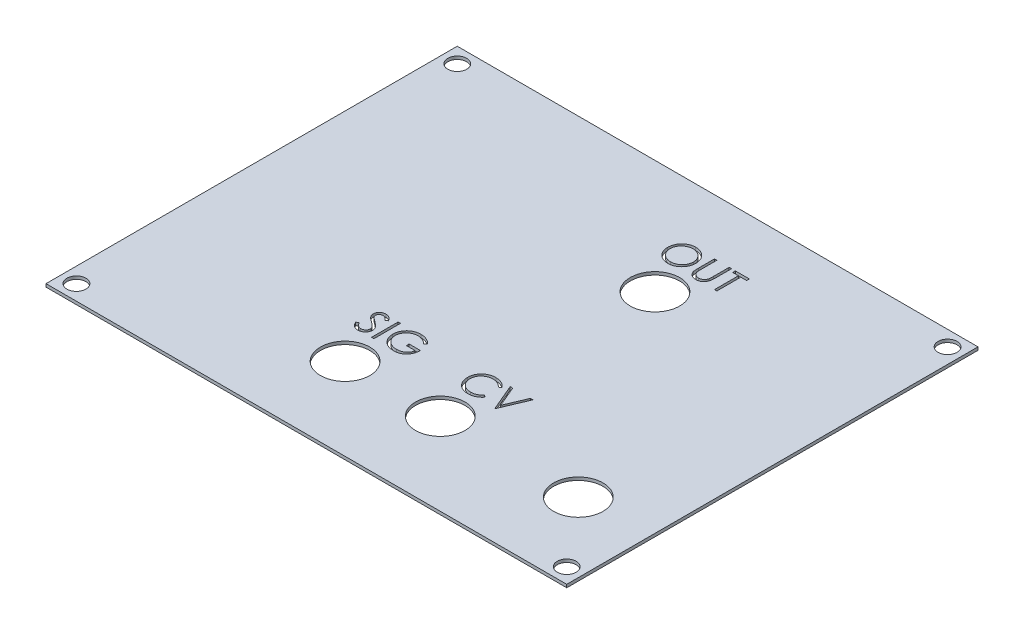
from build123d import *

# Parameters (mm, degrees)
SKETCH1_W           = 68.5
SKETCH1_H           = 54.1
SKETCH1_R           = 1.25
SKETCH1_R_2         = 3.25
BOSS_EXTRUDE1_DEPTH = 0.4
SKETCH2_W           = 0.314102564
SKETCH2_H           = 3.5
CUT_EXTRUDE1_DEPTH  = 0.4


with BuildPart() as part:
    # Sketch1 → Boss-Extrude1 (new body)
    with BuildSketch(Plane(origin=(0, 0, 0), x_dir=(1, 0, 0), z_dir=(0, 1, 0))):
        with Locations((32.25, 25.05)):
            Rectangle(SKETCH1_W, SKETCH1_H)
        with Locations(Location((0, 0, 0), (0, 0, 270))):
            Circle(SKETCH1_R, mode=Mode.SUBTRACT)
        with Locations(Location((0, 50.1, 0), (0, 0, 270))):
            Circle(SKETCH1_R, mode=Mode.SUBTRACT)
        with Locations(Location((64.5, 50.1, 0), (0, 0, 270))):
            Circle(SKETCH1_R, mode=Mode.SUBTRACT)
        with Locations(Location((64.5, 0, 0), (0, 0, 270))):
            Circle(SKETCH1_R, mode=Mode.SUBTRACT)
        with Locations(Location((26.516, 8.829, 0), (0, 0, 270))):
            Circle(SKETCH1_R_2, mode=Mode.SUBTRACT)
        with Locations(Location((39.036, 8.829, 0), (0, 0, 270))):
            Circle(SKETCH1_R_2, mode=Mode.SUBTRACT)
        with Locations(Location((57.33, 8.69, 0), (0, 0, 270))):
            Circle(SKETCH1_R_2, mode=Mode.SUBTRACT)
        with Locations(Location((38.979, 37.127, 0), (0, 0, 270))):
            Circle(SKETCH1_R_2, mode=Mode.SUBTRACT)
    extrude(amount=BOSS_EXTRUDE1_DEPTH)

    # Sketch2 → Cut-Extrude1 (cut)
    # profile 1 of 8: a face of its own
    with BuildSketch(Plane(origin=(0, 0.4, 0), x_dir=(1, 0, 0), z_dir=(0, 1, 0))):
        with BuildLine():
            Line((22.743722308, 13.978326651), (23.039595706, 14.155710465))
            add(Edge.make_bspline(
                [(23.039595706, 14.155710465), (23.067113943, 14.10964608), (23.119837824, 14.021388496), (23.207789183, 13.902130456), (23.298922094, 13.800768299), (23.393911428, 13.717891692), (23.492177376, 13.652642805), (23.59436143, 13.606440573), (23.70011924, 13.577624598), (23.772093062, 13.574124511), (23.808025193, 13.572377132)],
                knots=[0, 0, 0, 0, 1.272034388, 2.437168799, 3.508375237, 4.49857839, 5.41946034, 6.295179144, 7.148887113, 8, 8, 8, 8], degree=3))
            add(Edge.make_bspline(
                [(23.808025193, 13.572377132), (23.838712054, 13.573231804), (23.899548827, 13.574926195), (23.98911107, 13.591206997), (24.076092872, 13.616219126), (24.15870151, 13.652040057), (24.235797124, 13.695378543), (24.303403819, 13.74772472), (24.361849933, 13.806330926), (24.409659047, 13.871713581), (24.446339083, 13.942030729), (24.474531151, 14.014206681), (24.490176225, 14.089375249), (24.492532978, 14.139985712), (24.493722308, 14.16552617)],
                knots=[0, 0, 0, 0, 1.095163259, 2.171163733, 3.241058638, 4.321873601, 5.38011039, 6.391990106, 7.366004449, 8.327778327, 9.272591725, 10.192022065, 11.087607919, 12, 12, 12, 12], degree=3))
            add(Edge.make_bspline(
                [(24.493722308, 14.16552617), (24.492247998, 14.19466702), (24.48925094, 14.253906109), (24.46391946, 14.341305762), (24.424070213, 14.427798332), (24.387307569, 14.481299598), (24.368221507, 14.50907585)],
                knots=[0, 0, 0, 0, 0.938893495, 1.908633276, 2.914225137, 4, 4, 4, 4], degree=3))
            add(Edge.make_bspline(
                [(24.368221507, 14.50907585), (24.352550893, 14.529122673), (24.319652399, 14.571208472), (24.263094886, 14.633853707), (24.196728772, 14.698472126), (24.122825217, 14.767531183), (24.038692128, 14.83781898), (23.946964614, 14.912687258), (23.845300755, 14.989288835), (23.774001258, 15.040661401), (23.737211892, 15.067168799)],
                knots=[0, 0, 0, 0, 0.722233717, 1.516239348, 2.393582979, 3.351407094, 4.387010283, 5.505090956, 6.712668013, 8, 8, 8, 8], degree=3))
            add(Edge.make_bspline(
                [(23.737211892, 15.067168799), (23.700387896, 15.093397386), (23.629983219, 15.143544448), (23.531524637, 15.217968732), (23.443480174, 15.286012602), (23.366241157, 15.348316614), (23.29984156, 15.404889219), (23.243758149, 15.455187158), (23.199419592, 15.500570719), (23.174764012, 15.530012061), (23.163694264, 15.543230497)],
                knots=[0, 0, 0, 0, 1.452282411, 2.77665338, 3.964542531, 5.026858415, 5.96415736, 6.766646006, 7.446254459, 8, 8, 8, 8], degree=3))
            add(Edge.make_bspline(
                [(23.163694264, 15.543230497), (23.148221718, 15.563831534), (23.117792882, 15.604346238), (23.077626876, 15.667671096), (23.043487713, 15.732494361), (23.016725381, 15.798990226), (22.994189162, 15.866225154), (22.979031232, 15.9350764), (22.969539835, 16.005235019), (22.968567848, 16.052448519), (22.968081283, 16.076083061)],
                knots=[0, 0, 0, 0, 1.068054152, 2.10047183, 3.106115577, 4.101338837, 5.06977816, 6.043150881, 7.020423561, 8, 8, 8, 8], degree=3))
            add(Edge.make_bspline(
                [(22.968081283, 16.076083061), (22.969386492, 16.113112836), (22.971969012, 16.1863809), (22.993809529, 16.29341173), (23.028282423, 16.395598147), (23.076577311, 16.491928481), (23.138834664, 16.579894462), (23.210880638, 16.660507949), (23.296692124, 16.728276531), (23.390844747, 16.787488589), (23.49390112, 16.833834515), (23.601892023, 16.868795495), (23.714989095, 16.888604753), (23.79159223, 16.891447517), (23.830461091, 16.892889952)],
                knots=[0, 0, 0, 0, 1.005424448, 1.989358655, 2.955360095, 3.929531133, 4.905563448, 5.876582895, 6.856512386, 7.866279853, 8.892233794, 9.918561126, 10.94386622, 12, 12, 12, 12], degree=3))
            add(Edge.make_bspline(
                [(23.830461091, 16.892889952), (23.871705191, 16.891467401), (23.953726543, 16.8886384), (24.074375758, 16.864040868), (24.190536475, 16.823340197), (24.283979739, 16.777151539), (24.357112501, 16.731020123), (24.412885234, 16.689000299), (24.469402684, 16.64062519), (24.527120739, 16.585765944), (24.585061399, 16.523919193), (24.644084851, 16.455508504), (24.70432912, 16.380951948), (24.74308498, 16.327727447), (24.762953078, 16.300442036)],
                knots=[0, 0, 0, 0, 1.286793592, 2.559021753, 3.825965368, 5.121522368, 5.803751409, 6.523245864, 7.299691795, 8.125521123, 9.008227632, 9.944561021, 10.946284179, 12, 12, 12, 12], degree=3))
            Line((24.762953078, 16.300442036), (24.478998751, 16.085197645))
            add(Edge.make_bspline(
                [(24.478998751, 16.085197645), (24.461852818, 16.107286335), (24.428833761, 16.149823988), (24.378704274, 16.209395304), (24.331455626, 16.263811783), (24.284905227, 16.311076911), (24.241511595, 16.353779045), (24.199394553, 16.390338802), (24.159160202, 16.421114397), (24.108443291, 16.453957957), (24.044725573, 16.486514461), (23.964741037, 16.514063539), (23.881154761, 16.530618601), (23.82422513, 16.532807488), (23.795405001, 16.533915593)],
                knots=[0, 0, 0, 0, 1.181633172, 2.275549214, 3.290209073, 4.226197932, 5.078386478, 5.862611352, 6.581680152, 7.217281963, 8.414376989, 9.595101626, 10.782541182, 12, 12, 12, 12], degree=3))
            add(Edge.make_bspline(
                [(23.795405001, 16.533915593), (23.759248478, 16.532703893), (23.689524031, 16.530367244), (23.590533795, 16.504847259), (23.50143987, 16.464665399), (23.424887305, 16.408350421), (23.361150328, 16.341629428), (23.315044869, 16.264850573), (23.287294704, 16.18006817), (23.283908425, 16.120926514), (23.282183847, 16.090806619)],
                knots=[0, 0, 0, 0, 1.14458467, 2.207223713, 3.21896685, 4.227309161, 5.202851033, 6.127160689, 7.046193047, 8, 8, 8, 8], degree=3))
            add(Edge.make_bspline(
                [(23.282183847, 16.090806619), (23.282576974, 16.07205514), (23.28336387, 16.034521521), (23.294338667, 15.979070099), (23.308437996, 15.92375876), (23.330780628, 15.868836177), (23.361625932, 15.813341818), (23.402131108, 15.75632008), (23.45314442, 15.697268372), (23.492221432, 15.658860998), (23.512852917, 15.638583061)],
                knots=[0, 0, 0, 0, 0.858281714, 1.717966888, 2.583508476, 3.4729293, 4.427298488, 5.488583878, 6.674047936, 8, 8, 8, 8], degree=3))
            add(Edge.make_bspline(
                [(23.512852917, 15.638583061), (23.52051429, 15.631746036), (23.538715957, 15.615502827), (23.571991883, 15.588910547), (23.615934681, 15.556107774), (23.669396882, 15.515520458), (23.733364244, 15.468438996), (23.8078438, 15.415465383), (23.892005333, 15.354879924), (23.951727249, 15.312522384), (23.983305642, 15.290125529)],
                knots=[0, 0, 0, 0, 0.420754252, 0.999615792, 1.744751191, 2.668019286, 3.750313428, 4.999500688, 6.413464383, 8, 8, 8, 8], degree=3))
            add(Edge.make_bspline(
                [(23.983305642, 15.290125529), (24.021291555, 15.26248417), (24.094846012, 15.208960508), (24.199503591, 15.128544828), (24.2943974, 15.049897059), (24.379860603, 14.973519452), (24.456737512, 14.899991359), (24.524175232, 14.828428179), (24.582860913, 14.759342606), (24.646040131, 14.670770031), (24.710597951, 14.561988946), (24.766039458, 14.428710708), (24.800997805, 14.294914387), (24.805569321, 14.204987551), (24.807824873, 14.160618318)],
                knots=[0, 0, 0, 0, 1.163667725, 2.253281268, 3.268753668, 4.215851969, 5.092017293, 5.902905408, 6.650798638, 7.335211899, 8.59617414, 9.77448103, 10.901945474, 12, 12, 12, 12], degree=3))
            add(Edge.make_bspline(
                [(24.807824873, 14.160618318), (24.807167734, 14.129239953), (24.805866219, 14.067092569), (24.790905306, 13.975837492), (24.76898564, 13.887206623), (24.735948407, 13.80229551), (24.695625248, 13.719550747), (24.644459, 13.641142847), (24.585151316, 13.565336448), (24.517117551, 13.494152957), (24.442671648, 13.428806761), (24.363987954, 13.3706777), (24.280937681, 13.322209376), (24.193971364, 13.282658534), (24.103069027, 13.251725017), (24.008261244, 13.229312147), (23.909391732, 13.215556437), (23.842191251, 13.214128675), (23.808025193, 13.213402773)],
                knots=[0, 0, 0, 0, 0.983748083, 1.948392443, 2.894712957, 3.844097841, 4.80183111, 5.778335162, 6.776009319, 7.81870978, 8.863265674, 9.881300176, 10.883814829, 11.87499822, 12.874611388, 13.892143829, 14.928324115, 16, 16, 16, 16], degree=3))
            add(Edge.make_bspline(
                [(23.808025193, 13.213402773), (23.78158985, 13.213913954), (23.72905209, 13.21492988), (23.651342608, 13.22391116), (23.575203019, 13.236618264), (23.501588737, 13.256792334), (23.429551325, 13.281269311), (23.359404091, 13.311407643), (23.291113037, 13.347524845), (23.224295454, 13.38881987), (23.159121279, 13.436877614), (23.096201812, 13.492851111), (23.033472626, 13.555196616), (22.97278523, 13.625607179), (22.912912085, 13.702945262), (22.855033676, 13.787934445), (22.797951958, 13.880111799), (22.76213649, 13.944976885), (22.743722308, 13.978326651)],
                knots=[0, 0, 0, 0, 0.915332311, 1.819136955, 2.706846663, 3.586547465, 4.459518054, 5.340707479, 6.227863349, 7.133153174, 8.059268498, 9.028702269, 10.047606654, 11.120612155, 12.245963614, 13.433783089, 14.680604001, 16, 16, 16, 16], degree=3))
        make_face()
    # profile 2 of 8: a face of its own
    with BuildSketch(Plane(origin=(0, 0.4, 0), x_dir=(1, 0, 0), z_dir=(0, 1, 0))):
        with Locations((25.682824873, 15.053146363)):
            Rectangle(SKETCH2_W, SKETCH2_H)
    # profile 3 of 8: a face of its own
    with BuildSketch(Plane(origin=(0, 0.4, 0), x_dir=(1, 0, 0), z_dir=(0, 1, 0))):
        with BuildLine():
            Line((30.012953078, 16.205790593), (29.743722308, 15.95058226))
            add(Edge.make_bspline(
                [(29.743722308, 15.95058226), (29.69500342, 15.996413123), (29.598727374, 16.086981986), (29.441767131, 16.204492981), (29.278003497, 16.305159081), (29.108291, 16.387065318), (28.936832446, 16.452418078), (28.76590367, 16.498946218), (28.597257969, 16.528618756), (28.48509075, 16.532167125), (28.429820065, 16.533915593)],
                knots=[0, 0, 0, 0, 1.08915593, 2.152340314, 3.188132944, 4.216796309, 5.218260357, 6.173443236, 7.099959455, 8, 8, 8, 8], degree=3))
            add(Edge.make_bspline(
                [(28.429820065, 16.533915593), (28.395905365, 16.533501987), (28.328163924, 16.532675848), (28.22754198, 16.522131633), (28.127975343, 16.506966769), (28.029651969, 16.485024891), (27.932380682, 16.457215832), (27.83649979, 16.422430369), (27.741830435, 16.381875124), (27.649264354, 16.335012651), (27.559523851, 16.283532804), (27.474767015, 16.226484264), (27.394453616, 16.165695474), (27.320093191, 16.099644494), (27.251258004, 16.028929629), (27.186309632, 15.954866323), (27.127532336, 15.875431104), (27.074441171, 15.792085478), (27.027079553, 15.706293289), (26.985270899, 15.618880299), (26.950173811, 15.530136445), (26.922404356, 15.439950367), (26.899493702, 15.349019777), (26.883376095, 15.256715057), (26.874289373, 15.162937371), (26.872717593, 15.100140113), (26.871927437, 15.068571042)],
                knots=[0, 0, 0, 0, 1.02818874, 2.053710826, 3.065248034, 4.081641283, 5.106893873, 6.131558223, 7.173050175, 8.228653731, 9.27666206, 10.308777013, 11.325269123, 12.329503258, 13.32196095, 14.316845687, 15.314881793, 16.315733098, 17.311955233, 18.285320748, 19.252783886, 20.203351036, 21.145449891, 22.095197417, 23.042428769, 24, 24, 24, 24], degree=3))
            add(Edge.make_bspline(
                [(26.871927437, 15.068571042), (26.872683155, 15.036300225), (26.874192528, 14.971846711), (26.883852847, 14.875652639), (26.901781088, 14.780887236), (26.925748797, 14.687239103), (26.955729612, 14.594547855), (26.993102279, 14.503215345), (27.037367879, 14.413244954), (27.088604431, 14.325447337), (27.144790635, 14.239924314), (27.207733716, 14.159364792), (27.274594299, 14.082696015), (27.347808199, 14.011620251), (27.425027741, 13.944236355), (27.508560017, 13.882400833), (27.596762478, 13.82492261), (27.689769689, 13.77252609), (27.786572472, 13.725717555), (27.885829225, 13.684093658), (27.987857041, 13.649814321), (28.09211973, 13.621876217), (28.198493002, 13.59897592), (28.307516805, 13.58424344), (28.418389513, 13.573552609), (28.493128145, 13.572770939), (28.530781603, 13.572377132)],
                knots=[0, 0, 0, 0, 0.93586088, 1.869166235, 2.799637598, 3.729985548, 4.670839027, 5.622275134, 6.589130586, 7.576015415, 8.568469353, 9.55398029, 10.53834874, 11.515998671, 12.510579167, 13.508179873, 14.527009472, 15.561807829, 16.601455013, 17.643573243, 18.680854198, 19.719860599, 20.772568776, 21.833555941, 22.908541556, 24, 24, 24, 24], degree=3))
            add(Edge.make_bspline(
                [(28.530781603, 13.572377132), (28.576159951, 13.573325708), (28.665267708, 13.575188392), (28.796254151, 13.589688681), (28.922057221, 13.612335475), (29.042323425, 13.645501372), (29.157192445, 13.687805047), (29.267085387, 13.738800433), (29.371137045, 13.800443492), (29.469660219, 13.870017359), (29.560417404, 13.947532192), (29.642271528, 14.031176647), (29.713917018, 14.120544714), (29.776421717, 14.215110029), (29.828130371, 14.315655334), (29.870573166, 14.421687896), (29.903106458, 14.533255408), (29.916461433, 14.61034704), (29.923209488, 14.649300209)],
                knots=[0, 0, 0, 0, 1.13008108, 2.219097802, 3.278683437, 4.311054135, 5.322181354, 6.324827112, 7.324222904, 8.330512327, 9.32562643, 10.293043162, 11.24128371, 12.174520618, 13.111833804, 14.052305215, 15.015860969, 16, 16, 16, 16], degree=3))
            Line((29.923209488, 14.649300209), (28.756542821, 14.649300209))
            Line((28.756542821, 14.649300209), (28.756542821, 15.008274568))
            Line((28.756542821, 15.008274568), (30.237312052, 15.008274568))
            add(Edge.make_bspline(
                [(30.237312052, 15.008274568), (30.235606204, 14.941367079), (30.23226755, 14.810417037), (30.208848635, 14.619446766), (30.171032122, 14.439075073), (30.11937181, 14.269112001), (30.05249653, 14.109798409), (29.971124002, 13.960972542), (29.873951881, 13.823595862), (29.764441439, 13.696546858), (29.641541481, 13.583217646), (29.508572861, 13.483611708), (29.365315893, 13.399709093), (29.211906086, 13.33144843), (29.048845652, 13.278174435), (28.875757272, 13.240402859), (28.692875672, 13.217772895), (28.567538995, 13.214881516), (28.503437853, 13.213402773)],
                knots=[0, 0, 0, 0, 1.140356446, 2.231883559, 3.274166699, 4.278491846, 5.25512956, 6.21435461, 7.1637429, 8.11826594, 9.068280886, 10.0076534, 10.945064095, 11.891975133, 12.864533718, 13.863980011, 14.907571808, 16, 16, 16, 16], degree=3))
            add(Edge.make_bspline(
                [(28.503437853, 13.213402773), (28.463927718, 13.213971894), (28.386000997, 13.215094385), (28.270910069, 13.223071732), (28.158992449, 13.235352308), (28.05026444, 13.253897432), (27.944326097, 13.276612086), (27.841706513, 13.305698805), (27.74201477, 13.339367504), (27.645096785, 13.377663178), (27.551832238, 13.422034834), (27.461805721, 13.471344474), (27.374519595, 13.525337834), (27.29056843, 13.58494868), (27.209514809, 13.64973114), (27.131881365, 13.719815059), (27.057233487, 13.794986179), (27.010473024, 13.848365189), (26.986911411, 13.875261747)],
                knots=[0, 0, 0, 0, 1.107784379, 2.184907829, 3.233506516, 4.263428166, 5.276301166, 6.270063455, 7.25232949, 8.225834625, 9.190232166, 10.146266622, 11.1027726, 12.066435141, 13.031522626, 14.010570082, 14.99756817, 16, 16, 16, 16], degree=3))
            add(Edge.make_bspline(
                [(26.986911411, 13.875261747), (26.952725479, 13.9179324), (26.884921066, 14.002565417), (26.79764291, 14.138165362), (26.723241507, 14.278567222), (26.662873685, 14.42416185), (26.615735599, 14.574813063), (26.581929346, 14.730328354), (26.562122057, 14.890907985), (26.559268519, 14.99957325), (26.557824873, 15.054548606)],
                knots=[0, 0, 0, 0, 1.023165419, 2.029347347, 3.013907458, 3.994755782, 4.975994455, 5.96558838, 6.970761222, 8, 8, 8, 8], degree=3))
            add(Edge.make_bspline(
                [(26.557824873, 15.054548606), (26.558357111, 15.095714859), (26.559414823, 15.177524166), (26.572240339, 15.298981474), (26.590641757, 15.418282166), (26.617688811, 15.535328722), (26.651785076, 15.650199314), (26.694338562, 15.762947278), (26.743883458, 15.873639149), (26.801468954, 15.981513017), (26.865553414, 16.08513743), (26.935103634, 16.184095234), (27.011107234, 16.276584299), (27.092323034, 16.363775947), (27.179720024, 16.444574794), (27.272479448, 16.519728905), (27.370672791, 16.58933909), (27.474608971, 16.652308925), (27.582736655, 16.708872546), (27.694796656, 16.758461757), (27.810754767, 16.799445073), (27.929742245, 16.834218852), (28.052659746, 16.859933993), (28.178615282, 16.878582738), (28.308265394, 16.891343338), (28.395901424, 16.892369594), (28.440336892, 16.892889952)],
                knots=[0, 0, 0, 0, 1.008945113, 2.00506715, 2.99143336, 3.967273523, 4.948097931, 5.927297278, 6.919902385, 7.919676788, 8.923139349, 9.905703106, 10.883022732, 11.856032218, 12.825136022, 13.798837087, 14.781400844, 15.773989409, 16.776158564, 17.77167057, 18.775803737, 19.789618931, 20.80898985, 21.851988756, 22.910860228, 24, 24, 24, 24], degree=3))
            add(Edge.make_bspline(
                [(28.440336892, 16.892889952), (28.476575135, 16.892310461), (28.548431314, 16.891161397), (28.655357047, 16.883196749), (28.760630061, 16.870572867), (28.864406451, 16.853346081), (28.966332817, 16.82988239), (29.066699523, 16.801804106), (29.165652059, 16.769112283), (29.262880308, 16.730123437), (29.359038024, 16.685869812), (29.454659865, 16.636056389), (29.549419111, 16.579831385), (29.643480092, 16.517027849), (29.73743595, 16.448724431), (29.829800592, 16.372967608), (29.922803537, 16.292744852), (29.982605351, 16.235062668), (30.012953078, 16.205790593)],
                knots=[0, 0, 0, 0, 0.985871117, 1.954866573, 2.915460327, 3.869826059, 4.81536089, 5.759505086, 6.70452669, 7.649098992, 8.607881297, 9.583363685, 10.581137262, 11.603961102, 12.659522466, 13.73993555, 14.853081303, 16, 16, 16, 16], degree=3))
        make_face()
    # profile 4 of 8: a face of its own
    with BuildSketch(Plane(origin=(0, 0.4, 0), x_dir=(1, 0, 0), z_dir=(0, 1, 0))):
        with BuildLine():
            Line((39.813470763, 16.159843315), (39.538631019, 15.949506777))
            add(Edge.make_bspline(
                [(39.538631019, 15.949506777), (39.519025131, 15.972872747), (39.480077684, 16.019289663), (39.417418481, 16.084469207), (39.352116838, 16.145534468), (39.284197717, 16.202776348), (39.212438598, 16.254193114), (39.138577799, 16.302464217), (39.061379754, 16.345731955), (38.954628019, 16.398194941), (38.814980171, 16.452941096), (38.639185332, 16.498844327), (38.455674233, 16.528065503), (38.330476634, 16.531230344), (38.266796083, 16.53284011)],
                knots=[0, 0, 0, 0, 0.757959112, 1.505699292, 2.245454638, 2.979532153, 3.711538275, 4.438200793, 5.171680507, 5.909471876, 7.393775596, 8.890124382, 10.418191784, 12, 12, 12, 12], degree=3))
            add(Edge.make_bspline(
                [(38.266796083, 16.53284011), (38.231712784, 16.532436148), (38.161871791, 16.531631972), (38.058223318, 16.521022847), (37.956510267, 16.506111637), (37.8567988, 16.483986313), (37.759215842, 16.456013694), (37.66312344, 16.42258828), (37.56991284, 16.381233441), (37.478294602, 16.335525181), (37.390515391, 16.283897736), (37.307460343, 16.227584384), (37.229432375, 16.167215288), (37.156369763, 16.102564181), (37.088197815, 16.033922221), (37.025410504, 15.960557879), (36.968225094, 15.882705706), (36.915508069, 15.801392298), (36.868295335, 15.716854506), (36.828765456, 15.628779436), (36.793760334, 15.538675333), (36.766061091, 15.445524172), (36.744136574, 15.349981406), (36.729008911, 15.251790618), (36.71852044, 15.151156939), (36.717720263, 15.082947626), (36.717316917, 15.048565271)],
                knots=[0, 0, 0, 0, 1.054917814, 2.100044995, 3.131103042, 4.146048494, 5.169673617, 6.183595914, 7.203665975, 8.234915748, 9.262203917, 10.264457458, 11.251630812, 12.227803204, 13.197192746, 14.159520551, 15.12972552, 16.100847026, 17.073214652, 18.039054194, 19.002613845, 19.979014051, 20.95965708, 21.949030935, 22.966165397, 24, 24, 24, 24], degree=3))
            add(Edge.make_bspline(
                [(36.717316917, 15.048565271), (36.718578736, 14.996833951), (36.72105615, 14.895266366), (36.743104484, 14.746495755), (36.776609575, 14.603975081), (36.826825152, 14.468595239), (36.888744203, 14.338686881), (36.966984814, 14.216448028), (37.057601352, 14.100031463), (37.161875771, 13.992188515), (37.276281587, 13.89367479), (37.399029499, 13.806924209), (37.529813786, 13.734609326), (37.667190417, 13.67443338), (37.812216531, 13.628176652), (37.964631333, 13.595612528), (38.124103328, 13.574370348), (38.233072728, 13.57233666), (38.288530859, 13.571301649)],
                knots=[0, 0, 0, 0, 1.029171465, 2.020641659, 2.987623507, 3.938342917, 4.889210282, 5.84687017, 6.821220943, 7.821438502, 8.827599549, 9.822697543, 10.807740252, 11.797342354, 12.80366471, 13.83203677, 14.896651826, 16, 16, 16, 16], degree=3))
            add(Edge.make_bspline(
                [(38.288530859, 13.571301649), (38.349633548, 13.572990429), (38.469898257, 13.576314351), (38.646266283, 13.6044736), (38.815102049, 13.650131518), (38.976414635, 13.71402944), (39.129749281, 13.797094728), (39.275345942, 13.897792606), (39.413327512, 14.017080938), (39.496298795, 14.108164067), (39.538631019, 14.154634982)],
                knots=[0, 0, 0, 0, 1.028121516, 2.023589091, 2.998037872, 3.967518031, 4.937445131, 5.927275754, 6.942489185, 8, 8, 8, 8], degree=3))
            Line((39.538631019, 14.154634982), (39.813470763, 13.946401809))
            add(Edge.make_bspline(
                [(39.813470763, 13.946401809), (39.791352653, 13.917863357), (39.747222378, 13.860923151), (39.675764361, 13.780651441), (39.600487063, 13.705147406), (39.520831353, 13.635019784), (39.437713562, 13.568865319), (39.349641249, 13.508563487), (39.257772217, 13.453272603), (39.162417738, 13.402645679), (39.063679125, 13.357728432), (38.96167469, 13.319274664), (38.856844115, 13.286149774), (38.749182606, 13.258897838), (38.638466849, 13.237626754), (38.525096375, 13.223407079), (38.4088265, 13.213665164), (38.330385079, 13.212777249), (38.290634224, 13.21232729)],
                knots=[0, 0, 0, 0, 0.986787822, 1.968848986, 2.935600012, 3.899624008, 4.868462664, 5.837806735, 6.815139263, 7.798259679, 8.787526145, 9.778297419, 10.776456485, 11.791383307, 12.812564526, 13.85620153, 14.913611965, 16, 16, 16, 16], degree=3))
            add(Edge.make_bspline(
                [(38.290634224, 13.21232729), (38.252990557, 13.212589282), (38.178554867, 13.21310734), (38.068656115, 13.221499508), (37.961666535, 13.232949244), (37.857891909, 13.250189376), (37.756765934, 13.270533716), (37.659205349, 13.297804972), (37.564250139, 13.328354139), (37.472281798, 13.364259126), (37.383222098, 13.404775308), (37.297358287, 13.450566867), (37.214729855, 13.501248732), (37.134524434, 13.555703742), (37.05792685, 13.615681044), (36.984273325, 13.680347678), (36.913150849, 13.749485689), (36.869148164, 13.799340543), (36.847024449, 13.824406617)],
                knots=[0, 0, 0, 0, 1.114604814, 2.203992996, 3.262667896, 4.300477797, 5.318619304, 6.316056647, 7.298880507, 8.271930387, 9.238335007, 10.195173496, 11.151986948, 12.108099108, 13.064862484, 14.031167946, 15.010108607, 16, 16, 16, 16], degree=3))
            add(Edge.make_bspline(
                [(36.847024449, 13.824406617), (36.811588805, 13.867947806), (36.741145328, 13.954504516), (36.651019645, 14.094790497), (36.573872089, 14.241258706), (36.511496169, 14.394678635), (36.462733436, 14.554706022), (36.42895224, 14.721421537), (36.407000636, 14.894669479), (36.404490347, 15.012506267), (36.403214352, 15.072403412)],
                knots=[0, 0, 0, 0, 0.994628077, 1.977248131, 2.950237994, 3.925870899, 4.908910175, 5.911660606, 6.938484602, 8, 8, 8, 8], degree=3))
            add(Edge.make_bspline(
                [(36.403214352, 15.072403412), (36.404769546, 15.135358865), (36.407829292, 15.25921979), (36.433825088, 15.440993743), (36.475643884, 15.615145142), (36.535040772, 15.781348886), (36.610346124, 15.940479167), (36.703372738, 16.091320371), (36.81303988, 16.234837171), (36.938487448, 16.368851922), (37.076054783, 16.491391275), (37.223373597, 16.599197479), (37.380155544, 16.688914995), (37.544673395, 16.763911157), (37.718159077, 16.82155562), (37.900242446, 16.861908807), (38.090581361, 16.887025923), (38.220443786, 16.890201131), (38.286427493, 16.891814469)],
                knots=[0, 0, 0, 0, 1.032925535, 2.032216505, 3.007276963, 3.968222605, 4.92396291, 5.891752235, 6.871517503, 7.883894988, 8.900124299, 9.891468569, 10.874487609, 11.85992873, 12.854644235, 13.869047385, 14.917252991, 16, 16, 16, 16], degree=3))
            add(Edge.make_bspline(
                [(38.286427493, 16.891814469), (38.326641965, 16.891332331), (38.406242463, 16.890377987), (38.523995115, 16.881071845), (38.638637442, 16.865558239), (38.750248424, 16.844442169), (38.85937104, 16.818234847), (38.965171281, 16.784094549), (39.068269968, 16.745058018), (39.168016876, 16.700099552), (39.263933426, 16.64963281), (39.355989745, 16.594217187), (39.443454604, 16.533921381), (39.526943452, 16.469258206), (39.605059663, 16.398859647), (39.680021142, 16.324662051), (39.74928222, 16.244528227), (39.792035415, 16.188123293), (39.813470763, 16.159843315)],
                knots=[0, 0, 0, 0, 1.096760587, 2.17092713, 3.219439832, 4.250915756, 5.268269357, 6.278326846, 7.281116186, 8.274029601, 9.260640565, 10.235837813, 11.203064059, 12.156899882, 13.114053108, 14.069676657, 15.032185724, 16, 16, 16, 16], degree=3))
        make_face()
    # profile 5 of 8: a face of its own
    with BuildSketch(Plane(origin=(0, 0.4, 0), x_dir=(1, 0, 0), z_dir=(0, 1, 0))):
        Polygon((40.262188711, 16.80207088), (40.598727173, 16.80207088), (41.764692718, 14.045961104), (42.931359384, 16.80207088), (43.268598968, 16.80207088), (41.787829737, 13.30207088), (41.742957942, 13.30207088), align=None)
    # profile 6 of 8: a face of its own
    with BuildSketch(Plane(origin=(0, 0.4, 0), x_dir=(1, 0, 0), z_dir=(0, 1, 0))):
        with BuildLine():
            add(Edge.make_bspline(
                [(36.566035617, 44.885724828), (36.630843723, 44.884083348), (36.75813219, 44.880859347), (36.945207088, 44.856180244), (37.123802183, 44.813484854), (37.295372322, 44.756621871), (37.457865298, 44.680767486), (37.612504191, 44.589082338), (37.758921064, 44.480605879), (37.895142446, 44.356176652), (38.019799396, 44.220793198), (38.129625283, 44.076315288), (38.221667576, 43.923616486), (38.297253363, 43.763155655), (38.356551973, 43.595295687), (38.397471017, 43.419141684), (38.423609167, 43.235834994), (38.426664944, 43.11080813), (38.428215104, 43.047383482)],
                knots=[0, 0, 0, 0, 1.065120563, 2.091984664, 3.0946048, 4.079830382, 5.057816894, 6.036188127, 7.030412546, 8.04752943, 9.064399622, 10.05169764, 11.02544977, 11.989514704, 12.962713494, 13.945757189, 14.957906945, 16, 16, 16, 16], degree=3))
            add(Edge.make_bspline(
                [(38.428215104, 43.047383482), (38.426665172, 42.984426035), (38.423610075, 42.860329615), (38.397441297, 42.678186171), (38.356400298, 42.503095474), (38.297804031, 42.335349821), (38.222578553, 42.174772258), (38.129923382, 42.021785304), (38.020782171, 41.876338805), (37.89657532, 41.74002614), (37.761174278, 41.615028669), (37.615944011, 41.506109794), (37.464150691, 41.412385669), (37.303840983, 41.337601995), (37.137140946, 41.277830075), (36.962558623, 41.237077445), (36.780912069, 41.210790401), (36.657041065, 41.207771885), (36.594080489, 41.206237648)],
                knots=[0, 0, 0, 0, 1.043624062, 2.057103931, 3.04512605, 4.022047818, 4.998200453, 5.980619268, 6.982898556, 8.009068085, 9.034988726, 10.034168286, 11.015286542, 11.987931943, 12.962482838, 13.94673481, 14.956375938, 16, 16, 16, 16], degree=3))
            add(Edge.make_bspline(
                [(36.594080489, 41.206237648), (36.53065617, 41.207787035), (36.405629954, 41.210841289), (36.222092918, 41.237022694), (36.045815175, 41.277963998), (35.877300823, 41.336473434), (35.716455894, 41.412090665), (35.562965811, 41.504295044), (35.417446664, 41.613702185), (35.281104917, 41.737868759), (35.156355719, 41.873040311), (35.047596343, 42.017874566), (34.95537123, 42.169530023), (34.880007898, 42.328427547), (34.820343438, 42.49379899), (34.77963862, 42.666747467), (34.753302668, 42.846286973), (34.750267822, 42.968529872), (34.748727925, 43.030556558)],
                knots=[0, 0, 0, 0, 1.053102029, 2.075944431, 3.073151272, 4.055350789, 5.033113405, 6.020478099, 7.024410459, 8.052272461, 9.079885166, 10.07527673, 11.055994387, 12.023226415, 12.992069828, 13.970394897, 14.97016774, 16, 16, 16, 16], degree=3))
            add(Edge.make_bspline(
                [(34.748727925, 43.030556558), (34.74926256, 43.072189228), (34.750325086, 43.154929351), (34.763116779, 43.277795951), (34.78167848, 43.398686609), (34.808280393, 43.517257557), (34.84307206, 43.633218542), (34.884124087, 43.747369305), (34.934263932, 43.858553028), (34.99094458, 43.96729642), (35.054206388, 44.071904326), (35.124082138, 44.170783909), (35.198117506, 44.264764906), (35.2792809, 44.35141191), (35.364897345, 44.433245566), (35.456355723, 44.509008283), (35.553097968, 44.579383234), (35.655540348, 44.642803575), (35.761158622, 44.70016271), (35.8700354, 44.749384561), (35.980691972, 44.791630622), (36.09364662, 44.825871447), (36.208599392, 44.852903483), (36.325801176, 44.871310837), (36.445158603, 44.884135155), (36.525569921, 44.885192657), (36.566035617, 44.885724828)],
                knots=[0, 0, 0, 0, 1.037015668, 2.060948919, 3.074880161, 4.083647147, 5.086022904, 6.090072063, 7.104153813, 8.122640571, 9.144368836, 10.147691507, 11.138137339, 12.123020368, 13.103399296, 14.087645067, 15.080126199, 16.082011238, 17.087798457, 18.072939717, 19.057185487, 20.037253025, 21.01195951, 21.997135196, 22.992090687, 24, 24, 24, 24], degree=3))
        make_face()
        with BuildLine():
            add(Edge.make_bspline(
                [(36.581460296, 44.526750469), (36.548245663, 44.526345578), (36.48213393, 44.525539669), (36.383849394, 44.514923953), (36.28685746, 44.499794064), (36.191138098, 44.478212543), (36.097091808, 44.448808491), (36.003841967, 44.414967582), (35.912238913, 44.373746492), (35.822585055, 44.327173787), (35.73566998, 44.275624867), (35.653657279, 44.2186531), (35.576334635, 44.157594545), (35.503891368, 44.092306708), (35.436540196, 44.022457106), (35.372955495, 43.94910467), (35.315685913, 43.870152779), (35.263200336, 43.787742372), (35.216232496, 43.701980791), (35.174467141, 43.613770929), (35.140303132, 43.522393242), (35.112440756, 43.428839084), (35.089340945, 43.333256625), (35.074707021, 43.234920776), (35.063974662, 43.134325664), (35.063214816, 43.06634381), (35.062830489, 43.031958802)],
                knots=[0, 0, 0, 0, 1.008559885, 2.007477868, 2.99961109, 3.989939068, 4.984837346, 5.991145699, 7.001802488, 8.033829008, 9.059044045, 10.069351652, 11.065060232, 12.050310815, 13.029377138, 14.011219647, 14.996725999, 15.989392538, 16.977580475, 17.965360261, 18.951710183, 19.937753436, 20.929683414, 21.935841486, 22.955955122, 24, 24, 24, 24], degree=3))
            add(Edge.make_bspline(
                [(35.062830489, 43.031958802), (35.064105351, 42.981396581), (35.066613399, 42.881925051), (35.088570969, 42.736156907), (35.122392943, 42.596068621), (35.17225031, 42.462426711), (35.234600924, 42.334082429), (35.311627814, 42.212174324), (35.4028869, 42.09666945), (35.506550427, 41.988374181), (35.619873133, 41.889528376), (35.740205863, 41.802764968), (35.866259471, 41.729354718), (35.998362673, 41.669549646), (36.135810212, 41.622159908), (36.279487763, 41.589681277), (36.428438223, 41.568305821), (36.529968878, 41.566253065), (36.581460296, 41.565212007)],
                knots=[0, 0, 0, 0, 1.032063989, 2.030389145, 3.003944642, 3.970395727, 4.937377036, 5.913328081, 6.909231446, 7.93887556, 8.970685674, 9.976071282, 10.964166581, 11.944589148, 12.933237628, 13.927779006, 14.949070134, 16, 16, 16, 16], degree=3))
            add(Edge.make_bspline(
                [(36.581460296, 41.565212007), (36.616069798, 41.565687512), (36.684710834, 41.56663058), (36.786806357, 41.576129256), (36.887062568, 41.591361126), (36.985338848, 41.613291781), (37.08152366, 41.640738988), (37.176018463, 41.673346716), (37.267816753, 41.714027919), (37.358076591, 41.758975871), (37.444472833, 41.810216029), (37.526948365, 41.865254178), (37.603424345, 41.926222799), (37.675813416, 41.990540611), (37.743441105, 42.059504459), (37.805850089, 42.133024681), (37.862830222, 42.211565338), (37.915295868, 42.293850744), (37.962099131, 42.379846997), (38.00287823, 42.468376675), (38.037474346, 42.559221784), (38.065402851, 42.652513356), (38.087288312, 42.748074204), (38.102368232, 42.846032283), (38.112916671, 42.946191625), (38.113711748, 43.013935481), (38.11411254, 43.048084603)],
                knots=[0, 0, 0, 0, 1.047197238, 2.076906641, 3.100256066, 4.114471768, 5.12198147, 6.126382909, 7.136867548, 8.15857795, 9.17633901, 10.174870724, 11.156907918, 12.133735059, 13.104061851, 14.077631395, 15.04955518, 16.038496417, 17.029181396, 18.010275684, 18.986308667, 19.968651475, 20.955262928, 21.950658345, 22.966943676, 24, 24, 24, 24], degree=3))
            add(Edge.make_bspline(
                [(38.11411254, 43.048084603), (38.113711427, 43.082000108), (38.112915746, 43.149277758), (38.102373271, 43.248738576), (38.087272381, 43.345991788), (38.065509673, 43.440655591), (38.037459519, 43.532754116), (38.002872188, 43.622200863), (37.962086889, 43.709329058), (37.915278665, 43.793923355), (37.862662841, 43.875098093), (37.805168598, 43.952700506), (37.74180325, 44.025273247), (37.674377225, 44.094607941), (37.601206339, 44.159225831), (37.522622045, 44.219148352), (37.439578368, 44.275821626), (37.351651132, 44.326947188), (37.260907178, 44.37416142), (37.16779322, 44.414612424), (37.073364121, 44.448984543), (36.977860008, 44.478301508), (36.88047703, 44.499709538), (36.781873201, 44.514937588), (36.682184943, 44.525535974), (36.615141723, 44.526344352), (36.581460296, 44.526750469)],
                knots=[0, 0, 0, 0, 1.02996197, 2.043119294, 3.035359645, 4.018872909, 4.991431989, 5.957985074, 6.929999688, 7.912076566, 8.892894881, 9.867085534, 10.843653904, 11.817741046, 12.803660682, 13.806313499, 14.818574707, 15.856120519, 16.894564902, 17.924820532, 18.937903209, 19.946497019, 20.957711757, 21.963978472, 22.977135795, 24, 24, 24, 24], degree=3))
        make_face(mode=Mode.SUBTRACT)
    # profile 7 of 8: a face of its own
    with BuildSketch(Plane(origin=(0, 0.4, 0), x_dir=(1, 0, 0), z_dir=(0, 1, 0))):
        with BuildLine():
            Line((39.146163822, 44.795981238), (39.460266386, 44.795981238))
            Line((39.460266386, 44.795981238), (39.460266386, 42.698925949))
            add(Edge.make_bspline(
                [(39.460266386, 42.698925949), (39.460219642, 42.669245214), (39.460130937, 42.612920903), (39.460723451, 42.532752602), (39.46238282, 42.461480143), (39.463428979, 42.398828796), (39.465756313, 42.345086048), (39.46765436, 42.299960737), (39.470094916, 42.263666535), (39.473028034, 42.242485609), (39.474288822, 42.233381078)],
                knots=[0, 0, 0, 0, 1.528628734, 2.90083645, 4.128790002, 5.200304208, 6.127813768, 6.898992206, 7.526736466, 8, 8, 8, 8], degree=3))
            add(Edge.make_bspline(
                [(39.474288822, 42.233381078), (39.479466281, 42.200534314), (39.489529467, 42.136691585), (39.515175845, 42.045783303), (39.550993346, 41.963851845), (39.593436389, 41.888340554), (39.649369, 41.821351194), (39.716372535, 41.759639541), (39.797550304, 41.705667736), (39.88781091, 41.656316925), (39.985096147, 41.616651842), (40.084507413, 41.586658478), (40.184550393, 41.568379578), (40.251526558, 41.566263039), (40.284785617, 41.565212007)],
                knots=[0, 0, 0, 0, 1.035780045, 2.013197591, 2.933192213, 3.817615948, 4.702609284, 5.640816605, 6.646850145, 7.73207398, 8.84249596, 9.914020372, 10.964143139, 12, 12, 12, 12], degree=3))
            add(Edge.make_bspline(
                [(40.284785617, 41.565212007), (40.313339357, 41.566285857), (40.370281919, 41.568427356), (40.45488835, 41.581688787), (40.537288459, 41.605589352), (40.617889138, 41.636429111), (40.693440123, 41.677176702), (40.763983565, 41.724247541), (40.826947499, 41.779458417), (40.884405497, 41.840558762), (40.934440433, 41.909498562), (40.977811574, 41.9847767), (41.013337504, 42.067526047), (41.030881029, 42.125680469), (41.03989379, 42.155556558)],
                knots=[0, 0, 0, 0, 0.994687771, 1.983630487, 2.973142513, 3.978332533, 4.983357753, 5.956394766, 6.925816176, 7.893390482, 8.871859704, 9.88551698, 10.913711441, 12, 12, 12, 12], degree=3))
            add(Edge.make_bspline(
                [(41.03989379, 42.155556558), (41.042893915, 42.167905133), (41.049579404, 42.195422733), (41.055826448, 42.241944023), (41.062332974, 42.296833387), (41.066847544, 42.3604852), (41.071248764, 42.432686173), (41.073881837, 42.51381243), (41.07509887, 42.603569391), (41.07546155, 42.666206553), (41.075651002, 42.698925949)],
                knots=[0, 0, 0, 0, 0.558680831, 1.244966039, 2.062412453, 2.990489873, 4.051219941, 5.244515665, 6.560634259, 8, 8, 8, 8], degree=3))
            Line((41.075651002, 42.698925949), (41.075651002, 44.795981238))
            Line((41.075651002, 44.795981238), (41.389753566, 44.795981238))
            Line((41.389753566, 44.795981238), (41.389753566, 42.682099026))
            add(Edge.make_bspline(
                [(41.389753566, 42.682099026), (41.389499445, 42.644000647), (41.389003514, 42.569649345), (41.384702937, 42.460697986), (41.377845938, 42.357345004), (41.36815785, 42.259576508), (41.355320846, 42.167742348), (41.341045626, 42.08103758), (41.322866093, 42.000084588), (41.301632692, 41.92425217), (41.277359144, 41.852066657), (41.245917995, 41.783558042), (41.210493495, 41.716643642), (41.168478842, 41.652335533), (41.12126746, 41.59034898), (41.067815779, 41.531059905), (41.009891618, 41.473520859), (40.946532059, 41.419207793), (40.878781533, 41.369399116), (40.806841576, 41.325601345), (40.731264806, 41.288577727), (40.65224768, 41.258101803), (40.569756477, 41.235187204), (40.483789117, 41.218112048), (40.394149924, 41.20840975), (40.333185268, 41.20696782), (40.302313662, 41.206237648)],
                knots=[0, 0, 0, 0, 1.316592851, 2.569410997, 3.76748051, 4.895814652, 5.963796859, 6.97159953, 7.931736103, 8.829262218, 9.692595152, 10.560224239, 11.431080259, 12.30701507, 13.211635791, 14.121146779, 15.063487852, 16.031507147, 17.00238618, 17.966455255, 18.938106653, 19.907068911, 20.888905087, 21.893141452, 22.933117798, 24, 24, 24, 24], degree=3))
            add(Edge.make_bspline(
                [(40.302313662, 41.206237648), (40.268644559, 41.207022413), (40.2025859, 41.20856212), (40.105247833, 41.21738487), (40.011933637, 41.234003265), (39.92165776, 41.255163208), (39.835649263, 41.284346946), (39.752755818, 41.31844507), (39.674397137, 41.360322331), (39.599302008, 41.406915724), (39.529477252, 41.459340362), (39.465379849, 41.516480536), (39.406903979, 41.577420913), (39.355035282, 41.642821279), (39.308914398, 41.712172986), (39.269184184, 41.785672226), (39.23507094, 41.863290542), (39.217464373, 41.917243742), (39.208563662, 41.944518898)],
                knots=[0, 0, 0, 0, 1.13879206, 2.234305948, 3.301075583, 4.341971843, 5.366689343, 6.369221514, 7.369726634, 8.367512178, 9.355451585, 10.318319045, 11.268648973, 12.207971039, 13.137398894, 14.081662264, 15.030215811, 16, 16, 16, 16], degree=3))
            add(Edge.make_bspline(
                [(39.208563662, 41.944518898), (39.203386504, 41.963151473), (39.192157132, 42.003565942), (39.180131835, 42.07045243), (39.170022753, 42.147467348), (39.160517195, 42.234615966), (39.154908237, 42.331965833), (39.149990798, 42.439474749), (39.146129179, 42.55727271), (39.146151952, 42.639327226), (39.146163822, 42.682099026)],
                knots=[0, 0, 0, 0, 0.625038921, 1.35572334, 2.194682327, 3.136881307, 4.189498639, 5.346923369, 6.617055217, 8, 8, 8, 8], degree=3))
            Line((39.146163822, 42.682099026), (39.146163822, 44.795981238))
        make_face()
    # profile 8 of 8: a face of its own
    with BuildSketch(Plane(origin=(0, 0.4, 0), x_dir=(1, 0, 0), z_dir=(0, 1, 0))):
        Polygon((41.883343309, 44.437006879), (41.883343309, 44.795981238), (43.723086899, 44.795981238), (43.723086899, 44.437006879), (42.960266386, 44.437006879), (42.960266386, 41.295981238), (42.646163822, 41.295981238), (42.646163822, 44.437006879), align=None)
    extrude(amount=-CUT_EXTRUDE1_DEPTH, mode=Mode.SUBTRACT)


with BuildPart() as cut_extrude1_piece_1:
    # of the separate pieces the step leaves, piece 1, a body of its own (cut_extrude1_pieces)
    add(part.part.solids().sort_by_distance((-2, 0, -52.1))[0])


with BuildPart() as cut_extrude1_piece_2:
    # of the separate pieces the step leaves, piece 2, a body of its own (cut_extrude1_pieces)
    add(part.part.solids().sort_by_distance((36.581460296, 0, -44.526750469))[0])


solid = Compound([cut_extrude1_piece_1.part, cut_extrude1_piece_2.part])
